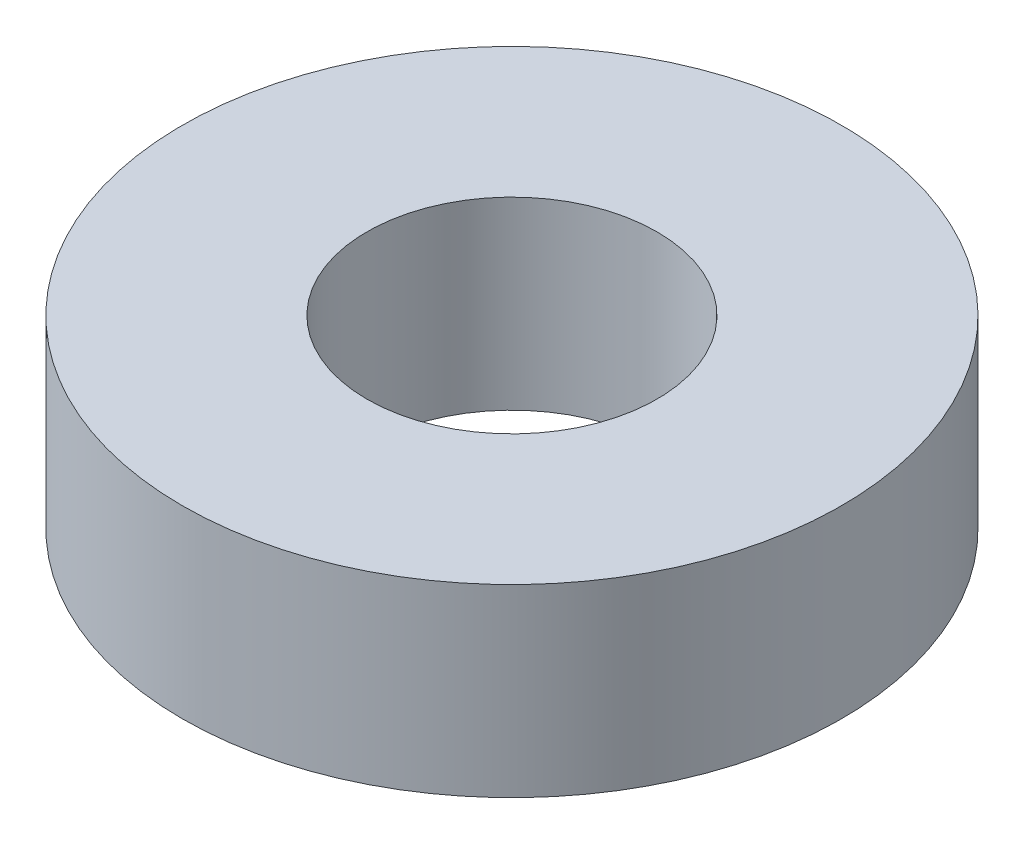
from build123d import *

# Parameters (mm, degrees)
CROQUIS1_R              = 50
CROQUIS1_R_2            = 22
SALIENTE_EXTRUIR1_DEPTH = 28


with BuildPart() as part:
    # Croquis1 → Saliente-Extruir1 (new body)
    with BuildSketch(Plane(origin=(0, 0, 0), x_dir=(1, 0, 0), z_dir=(0, 1, 0))):
        with Locations(Location((0, 0, 0), (0, 0, 270))):
            Circle(CROQUIS1_R)
        with Locations(Location((0, 0, 0), (0, 0, 270))):
            Circle(CROQUIS1_R_2, mode=Mode.SUBTRACT)
    extrude(amount=SALIENTE_EXTRUIR1_DEPTH)


solid = part.part
